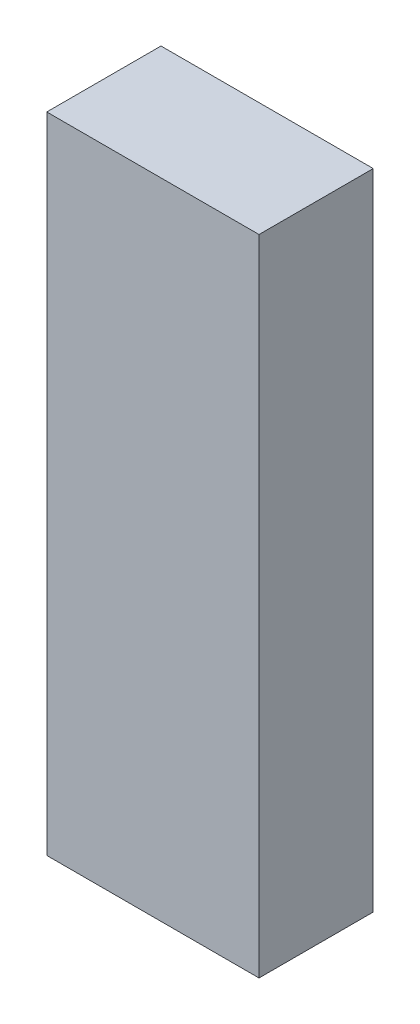
from build123d import *

# Parameters (mm, degrees)
BOSS_EXTRUDE1_DEPTH = 51
SKETCH2_W           = 17.735009552
SKETCH2_H           = 9.543683463
BOSS_EXTRUDE2_DEPTH = 1.4
BOSS_EXTRUDE3_START = -51
SKETCH2_2_W         = 17.735009552
SKETCH2_2_H         = 9.543683463
BOSS_EXTRUDE3_DEPTH = 1.4


with BuildPart() as part:
    # Sketch1 → Boss-Extrude1 (new body)
    with BuildSketch(Plane(origin=(0, 0, 0), x_dir=(1, 0, 0), z_dir=(0, 1, 0))):
        with BuildLine():
            Line((-6.860118192, 1.392400227), (-8.867504776, 1.392400227))
            Line((-8.867504776, 1.392400227), (-8.867504776, -8.151283236))
            Line((-8.867504776, -8.151283236), (8.867504776, -8.151283236))
            Line((8.867504776, -8.151283236), (8.867504776, 1.392400227))
            Line((8.867504776, 1.392400227), (6.860118192, 1.392400227))
            ThreePointArc((6.860118192, 1.392400227), (0, -7), (-6.860118192, 1.392400227))
        make_face()
    extrude(amount=BOSS_EXTRUDE1_DEPTH)

    # Sketch2 → Boss-Extrude2 (add)
    with BuildSketch(Plane.XZ):
        with Locations((0, 3.379441505)):
            Rectangle(SKETCH2_W, SKETCH2_H)
    extrude(amount=BOSS_EXTRUDE2_DEPTH)

    # Sketch2<2> → Boss-Extrude3 (add)
    with BuildSketch(Plane.XZ.offset(BOSS_EXTRUDE3_START)):
        with Locations((0, 3.379441505)):
            Rectangle(SKETCH2_2_W, SKETCH2_2_H)
    extrude(amount=-BOSS_EXTRUDE3_DEPTH)


solid = part.part
